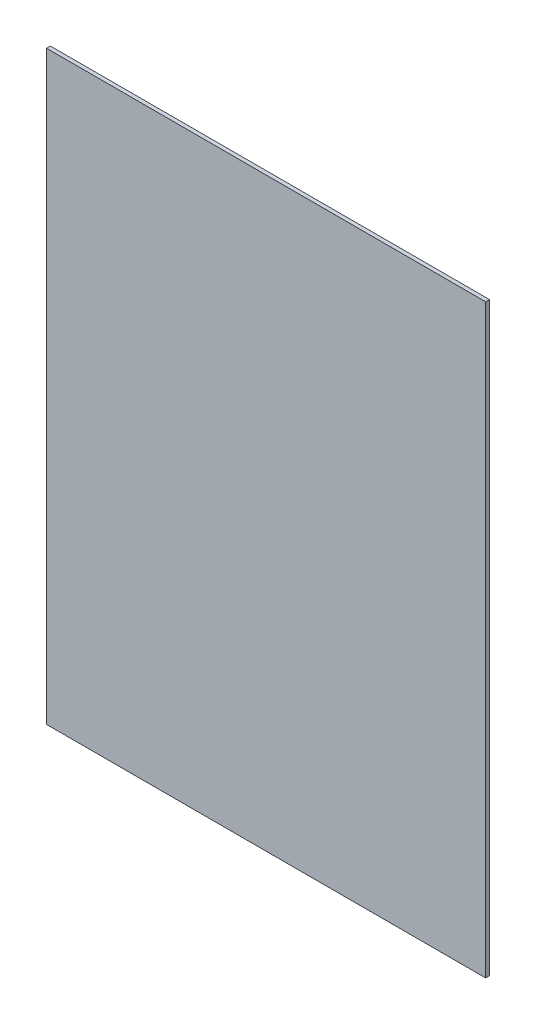
from build123d import *

# Parameters (mm, degrees)
SKETCH_1_W      = 1500
SKETCH_1_H      = 2000
EXTRUDE_1_DEPTH = 13


with BuildPart() as part:
    # 草图1 → 凸台-拉伸1 (new body)
    with BuildSketch(Plane.XY):
        Rectangle(SKETCH_1_W, SKETCH_1_H)
    extrude(amount=EXTRUDE_1_DEPTH)


solid = part.part
